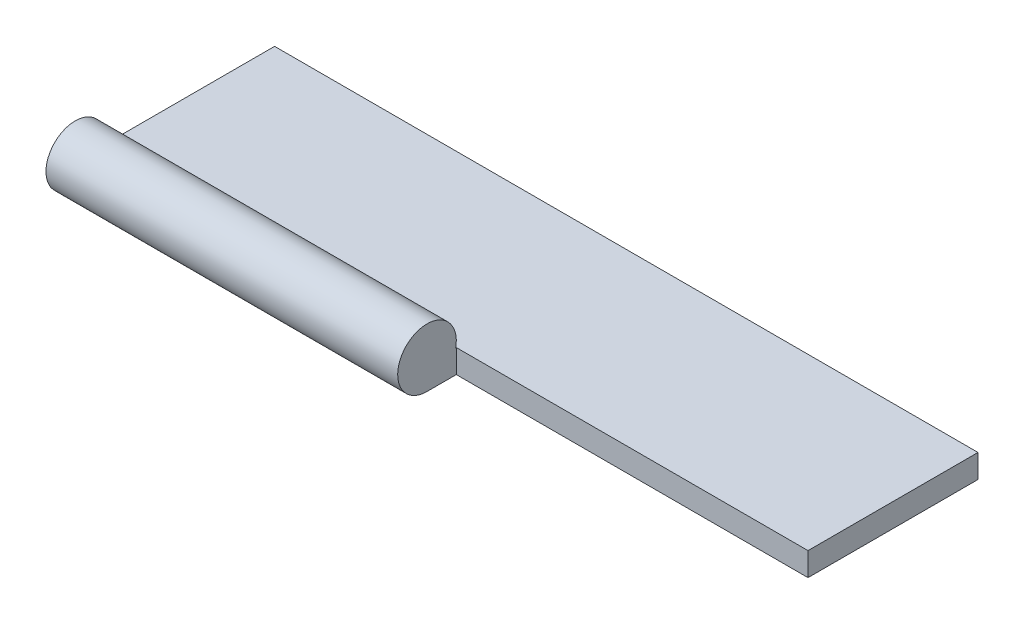
from build123d import *

# Parameters (mm, degrees)
BOSS_EXTRUDE1_DEPTH = 60
SKETCH3_W           = 31.691445316
SKETCH3_H           = 5
CUT_EXTRUDE1_DEPTH  = 63.561969278


with BuildPart() as part:
    # Sketch1 → Boss-Extrude1 (new body)
    with BuildSketch(Plane(origin=(0, 0, 0), x_dir=(0, 0, -1), z_dir=(1, 0, 0))):
        with BuildLine():
            Line((0, -2.5), (17, -2.5))
            Line((17, -2.5), (17, -0.5))
            Line((17, -0.5), (2.449489743, -0.5))
            ThreePointArc((2.449489743, -0.5), (-1.58113883, 1.936491673), (0, -2.5))
        make_face()
    extrude(amount=BOSS_EXTRUDE1_DEPTH)

    # Sketch3 → Cut-Extrude1 (cut, through all)
    with BuildSketch(Plane.XZ.offset(2.5)):
        with Locations((45.845722658, 0)):
            Rectangle(SKETCH3_W, SKETCH3_H)
    extrude(amount=-CUT_EXTRUDE1_DEPTH, mode=Mode.SUBTRACT)


solid = part.part
